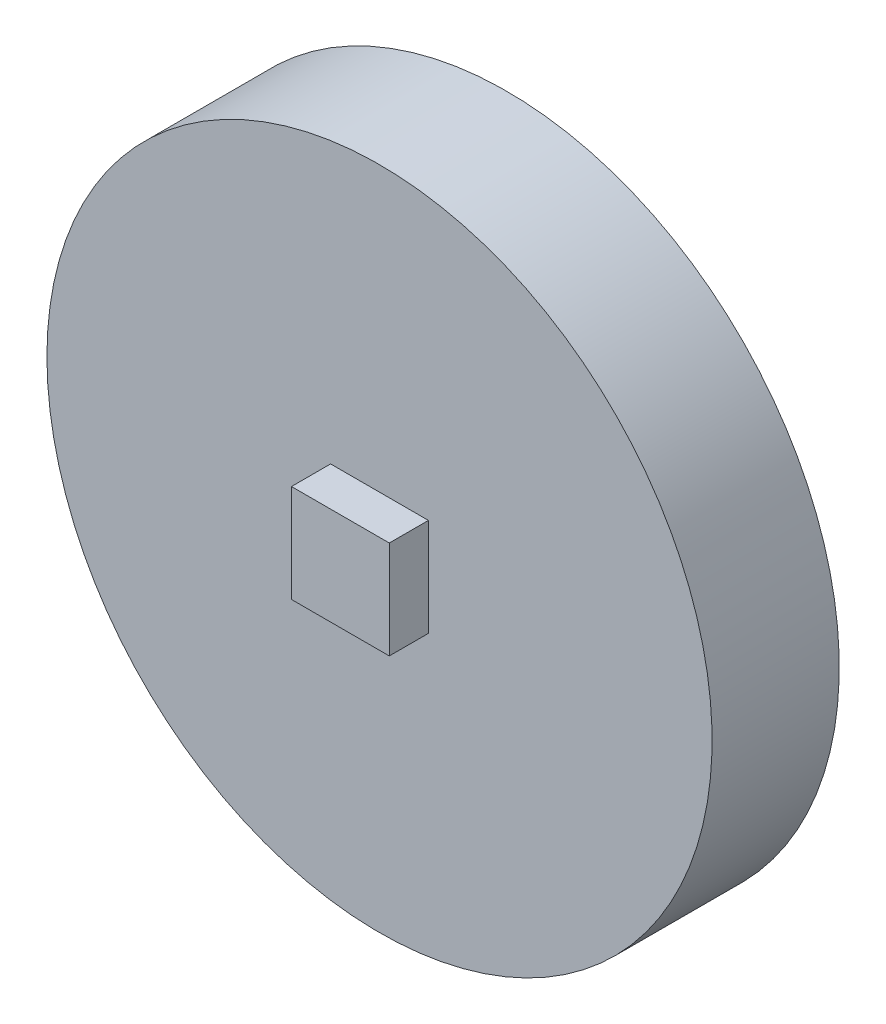
from build123d import *

# Parameters (mm, degrees)
SKETCH1_R           = 17
BOSS_EXTRUDE1_DEPTH = 6.5
SKETCH2_W           = 5
SKETCH2_H           = 5
BOSS_EXTRUDE2_DEPTH = 2


with BuildPart() as part:
    # Sketch1 → Boss-Extrude1 (new body)
    with BuildSketch(Plane.XY):
        with Locations(Location((0, 0, 0), (0, 0, 180))):
            Circle(SKETCH1_R)
    extrude(amount=BOSS_EXTRUDE1_DEPTH)

    # Sketch2 → Boss-Extrude2 (add)
    with BuildSketch(Plane.XY.offset(6.5)):
        Rectangle(SKETCH2_W, SKETCH2_H)
    extrude(amount=BOSS_EXTRUDE2_DEPTH)


solid = part.part
